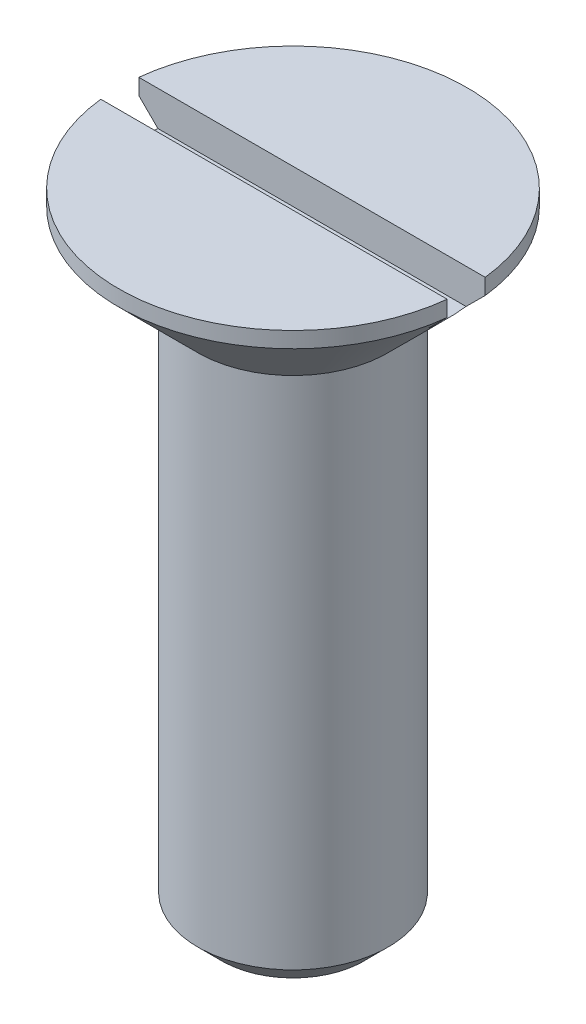
from build123d import *

# Parameters (mm, degrees)
SKETCH_13_W         = 12
SKETCH_13_H         = 1.2
CUT_EXTRUDE_9_DEPTH = 1.1
CHAMFER_1_SIZE      = 0.75


with BuildPart() as part:
    # Эскиз1 → Повернуть1 (revolve)
    with BuildSketch(Plane.XY):
        Polygon((0, 20), (0, 0), (3, 0), (3, 17), (5.5, 19.5), (5.5, 20), align=None)
    revolve(axis=Axis((0, 125.763182898, 0), (0, -1, 0)))

    # Эскиз13 → Вырез-Вытянуть9 (cut)
    with BuildSketch(Plane(origin=(0, 20, 0), x_dir=(-1, 0, 0), z_dir=(0, 1, 0))):
        Rectangle(SKETCH_13_W, SKETCH_13_H)
    extrude(amount=-CUT_EXTRUDE_9_DEPTH, mode=Mode.SUBTRACT)

    # Фаска1
    chamfer_1_edges = [part.edges().sort_by_distance(p)[0] for p in [
        (-3, 0, 0),
    ]]
    chamfer(chamfer_1_edges, length=CHAMFER_1_SIZE)


solid = part.part
